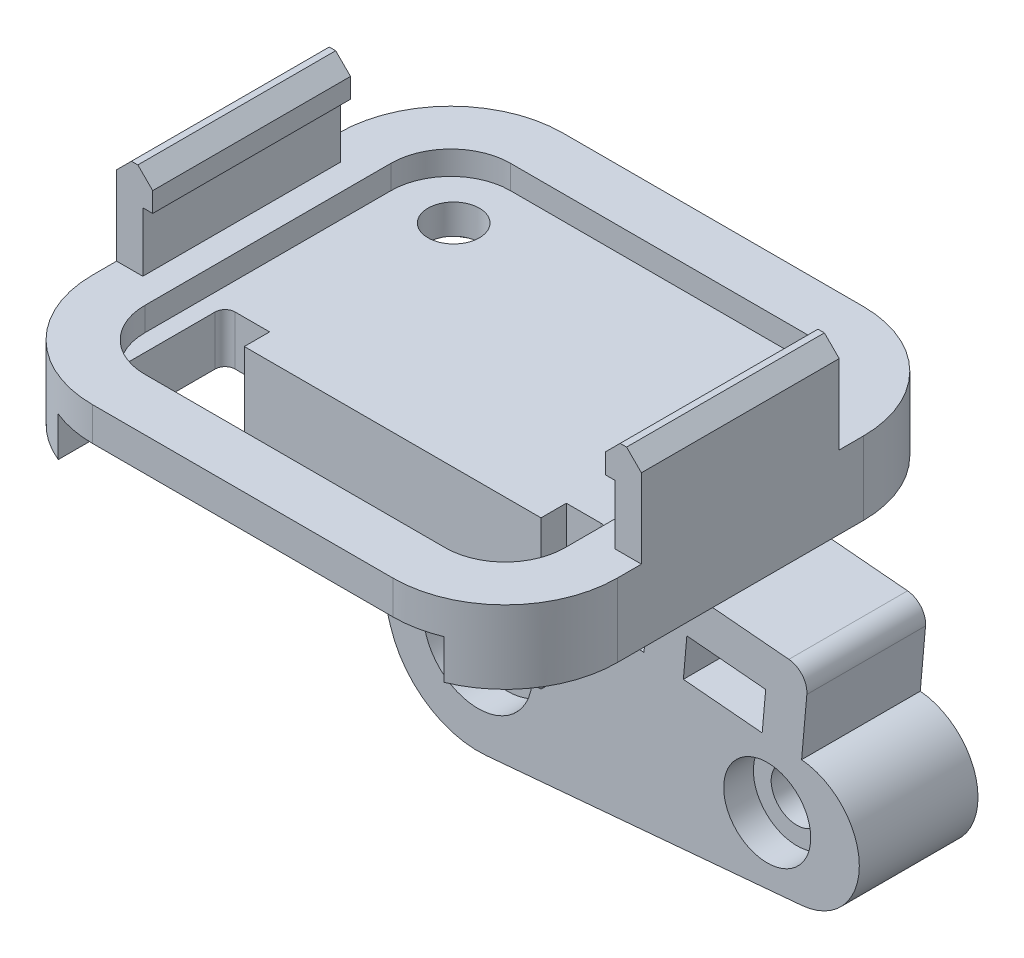
from build123d import *

# Parameters (mm, degrees)
BOSS_EXTRUDE1_DEPTH              = 3.7
CUT_EXTRUDE1_DEPTH               = 1.2
CUT_EXTRUDE2_DEPTH               = 2
CUT_EXTRUDE3_DEPTH               = 20.027535968
BOSS_EXTRUDE3_DEPTH              = 5
M2_CLEARANCE_HOLE1_D             = 2.6
CUT_EXTRUDE4_DEPTH               = 1
CHAMFER2_SIZE                    = 0.75
BOSS_EXTRUDE4_DEPTH              = 3
BOSS_EXTRUDE5_START              = 3
BOSS_EXTRUDE5_DEPTH              = 3
CBORE_FOR_M2_5_SHCS1_D           = 3.1
CBORE_FOR_M2_5_SHCS1_CBORE_D     = 5.5
CBORE_FOR_M2_5_SHCS1_CBORE_DEPTH = 1.5
CUT_EXTRUDE6_DEPTH               = 2.5
SKETCH18_R                       = 3.62
CUT_EXTRUDE7_DEPTH               = 1
CBORE_FOR_M2_SHCS1_D             = 2.6
CBORE_FOR_M2_SHCS1_CBORE_D       = 4.4
CBORE_FOR_M2_SHCS1_CBORE_DEPTH   = 1.5
CHAMFER3_SIZE                    = 0.5
BOSS_EXTRUDE8_DEPTH              = 7.5
BOSS_EXTRUDE9_DEPTH              = 6
FILLET1_R                        = 1


with BuildPart() as part:
    # Sketch1 → Boss-Extrude1 (new body)
    with BuildSketch(Plane(origin=(0, -6, 0), x_dir=(-1, 0, 0), z_dir=(0, -1, 0))):
        with BuildLine():
            Line((7.595, 10.65), (-7.595, 10.65))
            ThreePointArc((-7.595, 10.65), (-11.604295449, 8.989295449), (-13.265, 4.98))
            Line((-13.265, 4.98), (-13.265, -7.46))
            ThreePointArc((-13.265, -7.46), (-11.604295449, -11.469295449), (-7.595, -13.13))
            Line((-7.595, -13.13), (7.595, -13.13))
            ThreePointArc((7.595, -13.13), (11.604295449, -11.469295449), (13.265, -7.46))
            Line((13.265, -7.46), (13.265, 4.98))
            ThreePointArc((13.265, 4.98), (11.604295449, 8.989295449), (7.595, 10.65))
        make_face()
    extrude(amount=-BOSS_EXTRUDE1_DEPTH)

    # Sketch3 → Cut-Extrude1 (cut)
    with BuildSketch(Plane(origin=(0, -2.3, 0), x_dir=(1, 0, 0), z_dir=(0, 1, 0))):
        with BuildLine():
            Line((-7.595, -10.48), (7.595, -10.48))
            ThreePointArc((7.595, -10.48), (9.730462479, -9.595462479), (10.615, -7.46))
            Line((10.615, -7.46), (10.615, 4.98))
            ThreePointArc((10.615, 4.98), (9.730462479, 7.115462479), (7.595, 8))
            Line((7.595, 8), (-7.595, 8))
            ThreePointArc((-7.595, 8), (-9.730462479, 7.115462479), (-10.615, 4.98))
            Line((-10.615, 4.98), (-10.615, -7.46))
            ThreePointArc((-10.615, -7.46), (-9.730462479, -9.595462479), (-7.595, -10.48))
        make_face()
    extrude(amount=-CUT_EXTRUDE1_DEPTH, mode=Mode.SUBTRACT)

    # Sketch4 → Cut-Extrude2 (cut)
    with BuildSketch(Plane(origin=(0, -6, 0), x_dir=(1, 0, 0), z_dir=(0, 1, 0))):
        with BuildLine():
            Line((9.25, -4.27), (-9.25, -4.27))
            ThreePointArc((-9.25, -4.27), (-9.603553391, -4.416446609), (-9.75, -4.77))
            Line((-9.75, -4.77), (-9.75, -11.98))
            Line((-9.75, -11.98), (-9.75, -13.13))
            Line((-9.75, -13.13), (9.75, -13.13))
            Line((9.75, -13.13), (9.75, -11.98))
            Line((9.75, -11.98), (9.75, -4.77))
            ThreePointArc((9.75, -4.77), (9.603553391, -4.416446609), (9.25, -4.27))
        make_face()
    extrude(amount=CUT_EXTRUDE2_DEPTH, mode=Mode.SUBTRACT)

    # Sketch5 → Cut-Extrude3 (cut, through all)
    with BuildSketch(Plane(origin=(0, -2.3, 0), x_dir=(1, 0, 0), z_dir=(0, 1, 0))):
        with BuildLine():
            Line((-9.25, -9.63), (9.25, -9.63))
            ThreePointArc((9.25, -9.63), (9.603553391, -9.483553391), (9.75, -9.13))
            Line((9.75, -9.13), (9.75, -4.77))
            ThreePointArc((9.75, -4.77), (9.603553391, -4.416446609), (9.25, -4.27))
            Line((9.25, -4.27), (-9.25, -4.27))
            ThreePointArc((-9.25, -4.27), (-9.603553391, -4.416446609), (-9.75, -4.77))
            Line((-9.75, -4.77), (-9.75, -9.13))
            ThreePointArc((-9.75, -9.13), (-9.603553391, -9.483553391), (-9.25, -9.63))
        make_face()
    extrude(amount=-CUT_EXTRUDE3_DEPTH, mode=Mode.SUBTRACT)

    # Sketch6 → Boss-Extrude3 (add, symmetric)
    with BuildSketch(Plane(origin=(0, 0, 1.24), x_dir=(-1, 0, 0), z_dir=(0, 0, -1))):
        Polygon((-11.94, -2.3), (-11.94, 0.7), (-11.44, 0.7), (-11.44, 1.7), (-12.19, 2.45), (-13.265, 2.45), (-13.265, -2.3), align=None)
    boss_extrude3 = extrude(amount=BOSS_EXTRUDE3_DEPTH, both=True)

    # Mirror1: Boss-Extrude3 across plane
    add(boss_extrude3.mirror(Plane(origin=(0, 0, 0), x_dir=(0, 0, 1), z_dir=(1, 0, 0))))

    # M2 Clearance Hole1 (through all)
    with Locations(Plane(origin=(0, -3.5, 0), x_dir=(1, 0, 0), z_dir=(0, 1, 0))):
        with Locations((-7.615, 5.15), (7.615, 5.15)):
            Hole(M2_CLEARANCE_HOLE1_D / 2)

    # Sketch9 → Cut-Extrude4 (cut)
    with BuildSketch(Plane.XZ.offset(6)):
        Polygon((-7.615, -2.667393842), (-9.765, -3.908696921), (-9.765, -6.391303079), (-7.615, -7.632606158), (-5.465, -6.391303079), (-5.465, -3.908696921), align=None)
        Polygon((7.615, -2.667393842), (5.465, -3.908696921), (5.465, -6.391303079), (7.615, -7.632606158), (9.765, -6.391303079), (9.765, -3.908696921), align=None)
    extrude(amount=-CUT_EXTRUDE4_DEPTH, mode=Mode.SUBTRACT)

    # Chamfer2
    chamfer2_edges = [part.edges().sort_by_distance(p)[0] for p in [
        (-13.265, 2.45, 1.24),
        (13.265, 2.45, 1.24),
    ]]
    chamfer(chamfer2_edges, length=CHAMFER2_SIZE)

    # Sketch11 → Boss-Extrude4 (add)
    with BuildSketch(Plane(origin=(0, 0, -1.76), x_dir=(-1, 0, 0), z_dir=(0, 0, -1))):
        with BuildLine():
            Line((-16.362587065, -18.187498165), (-0.407985075, -19.601950475))
            ThreePointArc((-0.407985075, -19.601950475), (2.579168763, -18.833052112), (4.416654929, -16.355566021))
            Line((4.416654929, -16.355566021), (7.595, -6))
            Line((7.595, -6), (7.595, -3.5))
            Line((7.595, -3.5), (-7.595, -3.5))
            Line((-7.595, -3.5), (-7.595, -11.035213013))
            Line((-7.595, -11.035213013), (-16.362587065, -11.812501835))
            ThreePointArc((-16.362587065, -11.812501835), (-19.28, -15), (-16.362587065, -18.187498165))
        make_face()
    extrude(amount=-BOSS_EXTRUDE4_DEPTH)

    # Sketch12 → Boss-Extrude5 (add)
    with BuildSketch(Plane(origin=(0, 0, -1.76), x_dir=(-1, 0, 0), z_dir=(0, 0, -1)).offset(BOSS_EXTRUDE5_START)):
        with BuildLine():
            Line((-0.407985075, -10.398049525), (-16.362587065, -11.812501835))
            ThreePointArc((-16.362587065, -11.812501835), (-19.28, -15), (-16.362587065, -18.187498165))
            Line((-16.362587065, -18.187498165), (-0.407985075, -19.601950475))
            ThreePointArc((-0.407985075, -19.601950475), (4.62, -15), (-0.407985075, -10.398049525))
        make_face()
    extrude(amount=-BOSS_EXTRUDE5_DEPTH)

    # CBORE for M2.5 SHCS1 (through all)
    with Locations(Plane.XY.offset(1.24)):
        with Locations((0, -15)):
            CounterBoreHole(CBORE_FOR_M2_5_SHCS1_D / 2, CBORE_FOR_M2_5_SHCS1_CBORE_D / 2, CBORE_FOR_M2_5_SHCS1_CBORE_DEPTH)

    # Sketch17 → Cut-Extrude6 (cut)
    with BuildSketch(Plane(origin=(0, 0, -4.76), x_dir=(-1, 0, 0), z_dir=(0, 0, -1))):
        with BuildLine():
            Line((-0.319676617, -11.394142701), (-16.274278607, -12.808595012))
            ThreePointArc((-16.274278607, -12.808595012), (-18.28, -15), (-16.274278607, -17.191404988))
            Line((-16.274278607, -17.191404988), (-0.319676617, -18.605857299))
            ThreePointArc((-0.319676617, -18.605857299), (3.62, -15), (-0.319676617, -11.394142701))
        make_face()
    extrude(amount=-CUT_EXTRUDE6_DEPTH, mode=Mode.SUBTRACT)

    # Sketch18 → Cut-Extrude7 (cut)
    with BuildSketch(Plane(origin=(0, 0, -2.26), x_dir=(-1, 0, 0), z_dir=(0, 0, -1))):
        with Locations((0, -15)):
            Circle(SKETCH18_R)
    extrude(amount=-CUT_EXTRUDE7_DEPTH, mode=Mode.SUBTRACT)

    # CBORE for M2 SHCS1 (through all)
    with Locations(Plane.XY.offset(1.24)):
        with Locations((14.625, -15)):
            CounterBoreHole(CBORE_FOR_M2_SHCS1_D / 2, CBORE_FOR_M2_SHCS1_CBORE_D / 2, CBORE_FOR_M2_SHCS1_CBORE_DEPTH)

    # Chamfer3
    chamfer3_edges = [part.edges().sort_by_distance(p)[0] for p in [
        (6.54, -6, -3.288045382),
        (8.69, -6, -3.288045382),
        (5.465, -6, -5.15),
        (9.765, -6, -5.15),
        (6.54, -6, -7.011954618),
        (8.69, -6, -7.011954618),
        (-8.69, -6, -3.288045382),
        (-6.54, -6, -3.288045382),
        (-9.765, -6, -5.15),
        (-5.465, -6, -5.15),
        (-8.69, -6, -7.011954618),
        (-6.54, -6, -7.011954618),
    ]]
    chamfer(chamfer3_edges, length=CHAMFER3_SIZE)

    # Sketch30 → Boss-Extrude8 (add, symmetric)
    with BuildSketch(Plane(origin=(0, 0, 0), x_dir=(0, 0, -1), z_dir=(1, 0, 0))):
        Polygon((-5.55, -7.7), (-6.4, -9.05), (-6.4, -10.15), (-5.55, -11), (-3.77, -11), (-3.77, -3.5), (-5.55, -3.5), align=None)
    extrude(amount=BOSS_EXTRUDE8_DEPTH, both=True)

    # Sketch31 → Boss-Extrude9 (add)
    with BuildSketch(Plane.XY.offset(1.24)):
        Polygon((8.393841653, -11.106034173), (10.386028006, -11.282651089), (10.562644921, -9.290464736), (14.547017627, -9.643698567), (14.370400712, -11.63588492), (16.362587065, -11.812501835), (16.715820896, -7.828129129), (8.747075483, -7.121661467), align=None)
    extrude(amount=-BOSS_EXTRUDE9_DEPTH)

    # Fillet1
    fillet1_edges = [part.edges().sort_by_distance(p)[0] for p in [
        (8.747075483, -7.121661467, -1.76),
        (16.715820896, -7.828129129, -1.76),
    ]]
    fillet(fillet1_edges, radius=FILLET1_R)


solid = part.part
